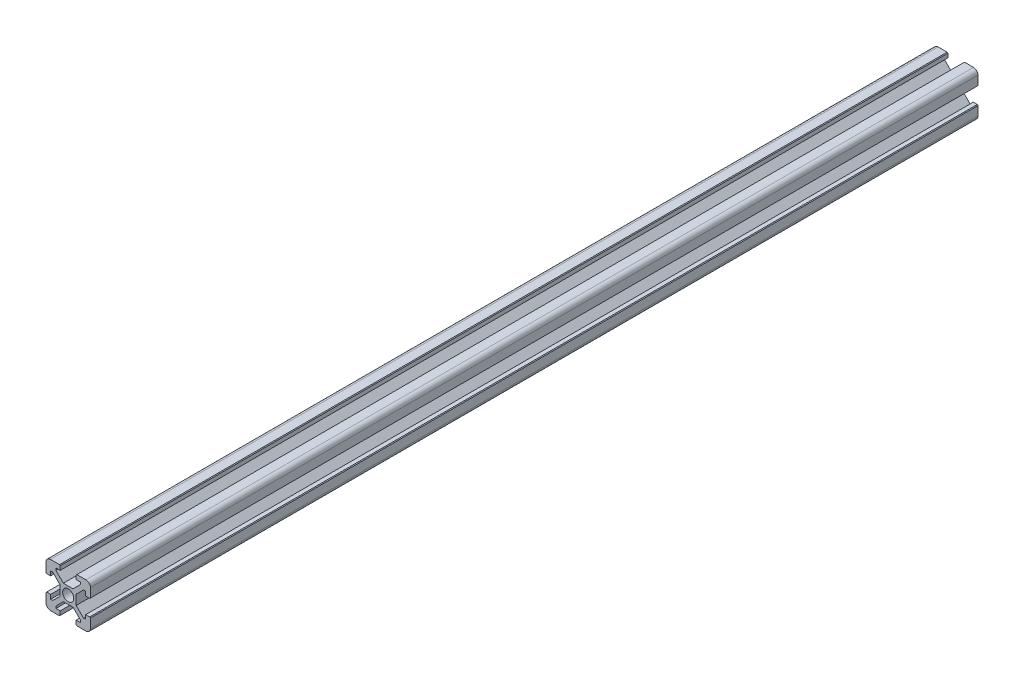
from build123d import *

# Parameters (mm, degrees)
SKETCH1_R           = 2.5
BOSS_EXTRUDE1_DEPTH = 400


with BuildPart() as part:
    # Sketch1 → Boss-Extrude1 (new body)
    with BuildSketch(Plane.XY):
        with BuildLine():
            Line((19.035670378, -71.15472155), (23.407243253, -71.15472155))
            Line((23.407243253, -71.15472155), (26.721456816, -67.840507987))
            Line((26.721456816, -67.840507987), (26.721456816, -66.85472155))
            Line((26.721456816, -66.85472155), (24.821456816, -66.85472155))
            Line((24.821456816, -66.85472155), (24.821456816, -65.05472155))
            Line((24.821456816, -65.05472155), (25.121456816, -64.75472155))
            Line((25.121456816, -64.75472155), (29.221456816, -64.75472155))
            ThreePointArc((29.221456816, -64.75472155), (30.635670378, -65.340507987), (31.221456816, -66.75472155))
            Line((31.221456816, -66.75472155), (31.221456816, -70.85472155))
            Line((31.221456816, -70.85472155), (30.921456816, -71.15472155))
            Line((30.921456816, -71.15472155), (29.121456816, -71.15472155))
            Line((29.121456816, -71.15472155), (29.121456816, -69.25472155))
            Line((29.121456816, -69.25472155), (28.135670378, -69.25472155))
            Line((28.135670378, -69.25472155), (24.821456816, -72.568935112))
            Line((24.821456816, -72.568935112), (24.821456816, -76.940507987))
            Line((24.821456816, -76.940507987), (28.135670378, -80.25472155))
            Line((28.135670378, -80.25472155), (29.121456816, -80.25472155))
            Line((29.121456816, -80.25472155), (29.121456816, -78.35472155))
            Line((29.121456816, -78.35472155), (30.921456816, -78.35472155))
            Line((30.921456816, -78.35472155), (31.221456816, -78.65472155))
            Line((31.221456816, -78.65472155), (31.221456816, -82.75472155))
            ThreePointArc((31.221456816, -82.75472155), (30.635670378, -84.168935112), (29.221456816, -84.75472155))
            Line((29.221456816, -84.75472155), (25.121456816, -84.75472155))
            Line((25.121456816, -84.75472155), (24.821456816, -84.45472155))
            Line((24.821456816, -84.45472155), (24.821456816, -82.65472155))
            Line((24.821456816, -82.65472155), (26.721456816, -82.65472155))
            Line((26.721456816, -82.65472155), (26.721456816, -81.668935112))
            Line((26.721456816, -81.668935112), (23.407243253, -78.35472155))
            Line((23.407243253, -78.35472155), (19.035670378, -78.35472155))
            Line((19.035670378, -78.35472155), (15.721456816, -81.668935112))
            Line((15.721456816, -81.668935112), (15.721456816, -82.65472155))
            Line((15.721456816, -82.65472155), (17.621456816, -82.65472155))
            Line((17.621456816, -82.65472155), (17.621456816, -84.45472155))
            Line((17.621456816, -84.45472155), (17.321456816, -84.75472155))
            Line((17.321456816, -84.75472155), (13.221456816, -84.75472155))
            ThreePointArc((13.221456816, -84.75472155), (11.807243253, -84.168935112), (11.221456816, -82.75472155))
            Line((11.221456816, -82.75472155), (11.221456816, -78.65472155))
            Line((11.221456816, -78.65472155), (11.521456816, -78.35472155))
            Line((11.521456816, -78.35472155), (13.321456816, -78.35472155))
            Line((13.321456816, -78.35472155), (13.321456816, -80.25472155))
            Line((13.321456816, -80.25472155), (14.307243253, -80.25472155))
            Line((14.307243253, -80.25472155), (17.621456816, -76.940507987))
            Line((17.621456816, -76.940507987), (17.621456816, -72.568935112))
            Line((17.621456816, -72.568935112), (14.307243253, -69.25472155))
            Line((14.307243253, -69.25472155), (13.321456816, -69.25472155))
            Line((13.321456816, -69.25472155), (13.321456816, -71.15472155))
            Line((13.321456816, -71.15472155), (11.521456816, -71.15472155))
            Line((11.521456816, -71.15472155), (11.221456816, -70.85472155))
            Line((11.221456816, -70.85472155), (11.221456816, -66.75472155))
            ThreePointArc((11.221456816, -66.75472155), (11.807243253, -65.340507987), (13.221456816, -64.75472155))
            Line((13.221456816, -64.75472155), (17.321456816, -64.75472155))
            Line((17.321456816, -64.75472155), (17.621456816, -65.05472155))
            Line((17.621456816, -65.05472155), (17.621456816, -66.85472155))
            Line((17.621456816, -66.85472155), (15.721456816, -66.85472155))
            Line((15.721456816, -66.85472155), (15.721456816, -67.840507987))
            Line((15.721456816, -67.840507987), (19.035670378, -71.15472155))
        make_face()
        with Locations((21.221456816, -74.75472155)):
            Circle(SKETCH1_R, mode=Mode.SUBTRACT)
    extrude(amount=-BOSS_EXTRUDE1_DEPTH)


solid = part.part
